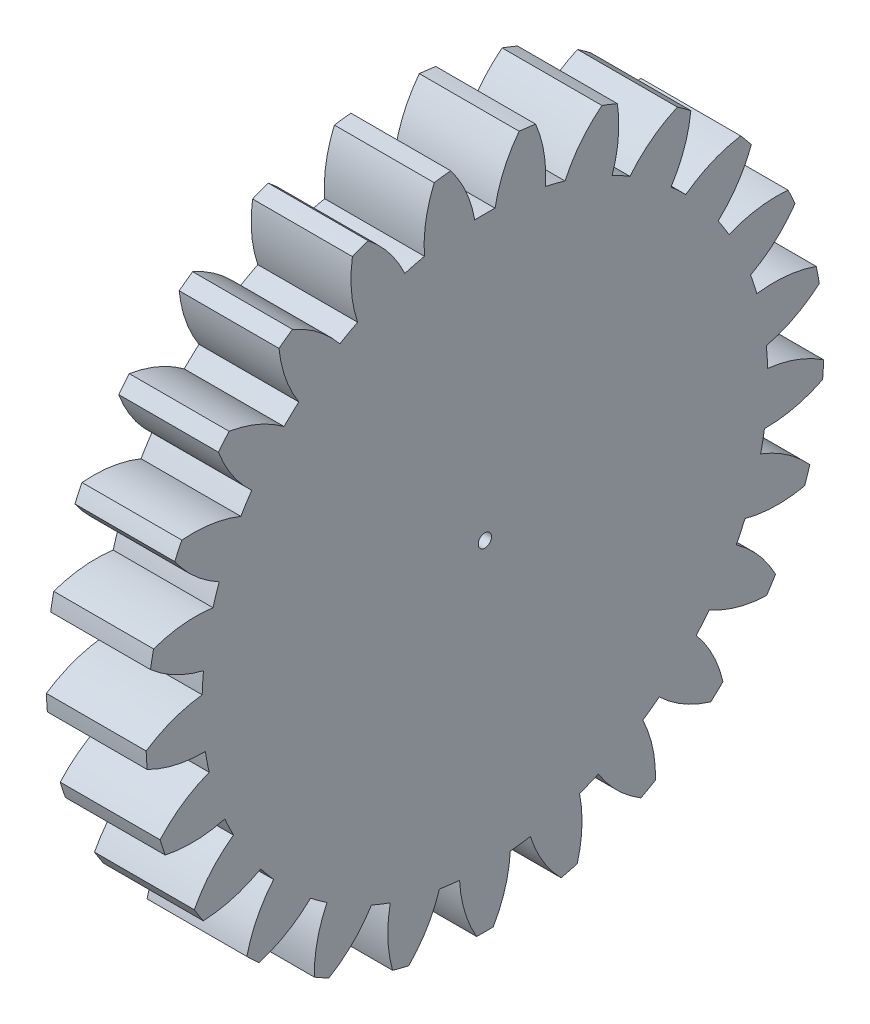
from build123d import *

# Parameters (mm, degrees)
BASPROSKE_W         = 6
BASPROSKE_H         = 20.25
TOOTHCUT_DEPTH      = 30.259613805
TEETHCUTS_COUNT     = 25
TEETHCUTS_ANGLE     = 345.6
BORSKE_R            = 0.4
BORE_DEPTH          = 50.0000508
SKETCH1_R           = 0.4
BOSS_EXTRUDE1_DEPTH = 6


with BuildPart() as part:
    # BasProSke → Base-Revolve (revolve)
    with BuildSketch(Plane(origin=(0, 0, 0), x_dir=(1, 0, 0), z_dir=(0, 1, 0)), mode=Mode.PRIVATE) as base_revolve_sk:
        with Locations((3, 10.125)):
            Rectangle(BASPROSKE_W, BASPROSKE_H)
    revolve(base_revolve_sk.sketch.rotate(Axis((-10, 0, 0), (1, 0, 0)), 180), axis=Axis((-10, 0, 0), (1, 0, 0)))

    # TooCutSke → ToothCut (cut, through all)
    with BuildSketch(Plane(origin=(0, 0, 0), x_dir=(0, 0, -1), z_dir=(1, 0, 0))):
        with BuildLine():
            ThreePointArc((0.713909619, 16.858891098), (0, 16.874), (-0.713909619, 16.858891098))
            ThreePointArc((-0.713909619, 16.858891098), (-1.221902209, 18.597177626), (-2.131751691, 20.163022588))
            ThreePointArc((-2.131751691, 20.163022588), (0, 20.2754), (2.131751691, 20.163022588))
            ThreePointArc((2.131751691, 20.163022588), (1.221902209, 18.597177626), (0.713909619, 16.858891098))
        make_face()
    toothcut = extrude(amount=TOOTHCUT_DEPTH, mode=Mode.SUBTRACT)

    # TeethCuts: ToothCut ×25 about axis
    teethcuts_axis = Axis((-10, 0, 0), (1, 0, 0))
    for i in range(1, TEETHCUTS_COUNT):
        add(toothcut.rotate(teethcuts_axis, i * TEETHCUTS_ANGLE / (TEETHCUTS_COUNT - 1)), mode=Mode.SUBTRACT)

    # BorSke → Bore (cut, symmetric)
    with BuildSketch(Plane(origin=(0, 0, 0), x_dir=(0, 0, -1), z_dir=(1, 0, 0))):
        with Locations(Location((0, 0, 0), (0, 0, 180))):
            Circle(BORSKE_R)
    extrude(amount=BORE_DEPTH, both=True, mode=Mode.SUBTRACT)

    # Sketch1 → Boss-Extrude1 (add)
    with BuildSketch(Plane(origin=(6, 0, 0), x_dir=(0, 0, -1), z_dir=(1, 0, 0))):
        with BuildLine():
            ThreePointArc((7.033321313, 19.122578704), (5.755923301, 17.845039552), (4.814939591, 16.302832813))
            ThreePointArc((4.814939591, 16.302832813), (4.227479392, 16.464945156), (3.634585878, 16.605896136))
            ThreePointArc((3.634585878, 16.605896136), (3.55295933, 18.410664563), (3.049026099, 20.145571842))
            ThreePointArc((3.049026099, 20.145571842), (2.553664634, 20.214337039), (2.056764651, 20.270923614))
            ThreePointArc((2.056764651, 20.270923614), (1.137209513, 18.715844736), (0.609319757, 16.988076125))
            ThreePointArc((0.609319757, 16.988076125), (0, 16.999), (-0.609319757, 16.988076125))
            ThreePointArc((-0.609319757, 16.988076125), (-1.137209513, 18.715844736), (-2.056764651, 20.270923614))
            ThreePointArc((-2.056764651, 20.270923614), (-2.553664634, 20.214337039), (-3.049026099, 20.145571842))
            ThreePointArc((-3.049026099, 20.145571842), (-3.55295933, 18.410664563), (-3.634585878, 16.605896136))
            ThreePointArc((-3.634585878, 16.605896136), (-4.227479392, 16.464945156), (-4.814939591, 16.302832813))
            ThreePointArc((-4.814939591, 16.302832813), (-5.755923301, 17.845039552), (-7.033321313, 19.122578704))
            ThreePointArc((-7.033321313, 19.122578704), (-7.500537761, 18.9441959), (-7.963235326, 18.754399701))
            ThreePointArc((-7.963235326, 18.754399701), (-8.019882673, 16.948674626), (-7.650117116, 15.180306621))
            ThreePointArc((-7.650117116, 15.180306621), (-8.189330706, 14.896337254), (-8.718019063, 14.593222558))
            ThreePointArc((-8.718019063, 14.593222558), (-10.012971259, 15.852964904), (-11.567948531, 16.772691847))
            ThreePointArc((-11.567948531, 16.772691847), (-11.976124515, 16.48372126), (-12.37708519, 16.184819653))
            ThreePointArc((-12.37708519, 16.184819653), (-11.982887291, 14.421737129), (-11.18496336, 12.800882612))
            ThreePointArc((-11.18496336, 12.800882612), (-11.636616254, 12.391737698), (-12.073313334, 11.966666459))
            ThreePointArc((-12.073313334, 11.966666459), (-13.640867407, 12.864790167), (-15.375718999, 13.368915074))
            ThreePointArc((-15.375718999, 13.368915074), (-15.699207322, 12.987513791), (-16.013237272, 12.598287862))
            ThreePointArc((-16.013237272, 12.598287862), (-15.192963031, 10.988628849), (-14.01701722, 9.61713207))
            ThreePointArc((-14.01701722, 9.61713207), (-14.352730406, 9.108519688), (-14.669996926, 8.588200696))
            ThreePointArc((-14.669996926, 8.588200696), (-16.411657689, 9.068273351), (-18.217376494, 9.125120201))
            ThreePointArc((-18.217376494, 9.125120201), (-18.435851194, 8.675253066), (-18.643218764, 8.220159312))
            ThreePointArc((-18.643218764, 8.220159312), (-17.448409029, 6.865064605), (-15.968330338, 5.82910175))
            ThreePointArc((-15.968330338, 5.82910175), (-16.167009721, 5.252979887), (-16.344910658, 4.670106699))
            ThreePointArc((-16.344910658, 4.670106699), (-18.15124316, 4.70196357), (-19.914369225, 4.307960465))
            ThreePointArc((-19.914369225, 4.307960465), (-20.014102734, 3.817894285), (-20.101778256, 3.32552792))
            ThreePointArc((-20.101778256, 3.32552792), (-18.607507316, 2.310143104), (-16.916294533, 1.674807529))
            ThreePointArc((-16.916294533, 1.674807529), (-16.965456357, 1.067376041), (-16.992813542, 0.458572722))
            ThreePointArc((-16.992813542, 0.458572722), (-18.750319268, 0.040212124), (-20.360068898, -0.77988427))
            ThreePointArc((-20.360068898, -0.77988427), (-20.334794592, -1.279356835), (-20.297269091, -1.778058621))
            ThreePointArc((-20.297269091, -1.778058621), (-18.597427484, -2.389933184), (-16.801345729, -2.584721008))
            ThreePointArc((-16.801345729, -2.584721008), (-16.697900975, -3.185294967), (-16.572995455, -3.781775066))
            ThreePointArc((-16.572995455, -3.781775066), (-18.171243857, -4.624065996), (-19.526470563, -5.818726009))
            ThreePointArc((-19.526470563, -5.818726009), (-19.37777652, -6.29622126), (-19.21740786, -6.769923199))
            ThreePointArc((-19.21740786, -6.769923199), (-17.418802888, -6.939841181), (-15.630706582, -6.681842018))
            ThreePointArc((-15.630706582, -6.681842018), (-15.381155065, -7.237822177), (-15.111835113, -7.784500017))
            ThreePointArc((-15.111835113, -7.784500017), (-16.450402366, -8.997797045), (-17.465952269, -10.491955792))
            ThreePointArc((-17.465952269, -10.491955792), (-17.203181482, -10.917470948), (-16.930046218, -11.336408605))
            ThreePointArc((-16.930046218, -11.336408605), (-15.145690844, -11.053693433), (-13.477932654, -10.35911832))
            ThreePointArc((-13.477932654, -10.35911832), (-13.097954614, -10.835570402), (-12.701142593, -11.298096204))
            ThreePointArc((-12.701142593, -11.298096204), (-13.695921594, -12.806163413), (-14.307983958, -14.505937407))
            ThreePointArc((-14.307983958, -14.505937407), (-13.947647283, -14.852735784), (-13.578907507, -15.190585766))
            ThreePointArc((-13.578907507, -15.190585766), (-11.920919342, -14.473001475), (-10.47829065, -13.38549312))
            ThreePointArc((-10.47829065, -13.38549312), (-9.991761504, -13.752479887), (-9.492390573, -14.101791454))
            ThreePointArc((-9.492390573, -14.101791454), (-10.080875698, -15.809871436), (-10.250992395, -17.608457625))
            ThreePointArc((-10.250992395, -17.608457625), (-9.81573111, -17.854748606), (-9.374556097, -18.090282557))
            ThreePointArc((-9.374556097, -18.090282557), (-7.947112637, -16.982917606), (-6.820259107, -15.570808159))
            ThreePointArc((-6.820259107, -15.570808159), (-6.257749271, -15.805270484), (-5.687196742, -16.019419285))
            ThreePointArc((-5.687196742, -16.019419285), (-5.832411307, -17.820187093), (-5.549893279, -19.604573691))
            ThreePointArc((-5.549893279, -19.604573691), (-5.067056451, -19.734881908), (-4.581166851, -19.853300363))
            ThreePointArc((-4.581166851, -19.853300363), (-3.473959616, -18.425734565), (-2.733685602, -16.777752055))
            ThreePointArc((-2.733685602, -16.777752055), (-2.130539637, -16.864957808), (-1.524655424, -16.930488086))
            ThreePointArc((-1.524655424, -16.930488086), (-1.217475063, -18.710794856), (-0.500073957, -20.368862291))
            ThreePointArc((-0.500073957, -20.368862291), (0, -20.375), (0.500073957, -20.368862291))
            ThreePointArc((0.500073957, -20.368862291), (1.217475063, -18.710794856), (1.524655424, -16.930488086))
            ThreePointArc((1.524655424, -16.930488086), (2.130539637, -16.864957808), (2.733685602, -16.777752055))
            ThreePointArc((2.733685602, -16.777752055), (3.473959616, -18.425734565), (4.581166851, -19.853300363))
            ThreePointArc((4.581166851, -19.853300363), (5.067056451, -19.734881908), (5.549893279, -19.604573691))
            ThreePointArc((5.549893279, -19.604573691), (5.832411307, -17.820187093), (5.687196742, -16.019419285))
            ThreePointArc((5.687196742, -16.019419285), (6.257749271, -15.805270484), (6.820259107, -15.570808159))
            ThreePointArc((6.820259107, -15.570808159), (7.947112637, -16.982917606), (9.374556097, -18.090282557))
            ThreePointArc((9.374556097, -18.090282557), (9.81573111, -17.854748606), (10.250992395, -17.608457625))
            ThreePointArc((10.250992395, -17.608457625), (10.080875698, -15.809871436), (9.492390573, -14.101791454))
            ThreePointArc((9.492390573, -14.101791454), (9.991761504, -13.752479887), (10.47829065, -13.38549312))
            ThreePointArc((10.47829065, -13.38549312), (11.920919342, -14.473001475), (13.578907507, -15.190585766))
            ThreePointArc((13.578907507, -15.190585766), (13.947647283, -14.852735784), (14.307983958, -14.505937407))
            ThreePointArc((14.307983958, -14.505937407), (13.695921594, -12.806163413), (12.701142593, -11.298096204))
            ThreePointArc((12.701142593, -11.298096204), (13.097954614, -10.835570402), (13.477932654, -10.35911832))
            ThreePointArc((13.477932654, -10.35911832), (15.145690844, -11.053693433), (16.930046218, -11.336408605))
            ThreePointArc((16.930046218, -11.336408605), (17.203181482, -10.917470948), (17.465952269, -10.491955792))
            ThreePointArc((17.465952269, -10.491955792), (16.450402366, -8.997797045), (15.111835113, -7.784500017))
            ThreePointArc((15.111835113, -7.784500017), (15.381155065, -7.237822177), (15.630706582, -6.681842018))
            ThreePointArc((15.630706582, -6.681842018), (17.418802888, -6.939841181), (19.21740786, -6.769923199))
            ThreePointArc((19.21740786, -6.769923199), (19.37777652, -6.29622126), (19.526470563, -5.818726009))
            ThreePointArc((19.526470563, -5.818726009), (18.171243857, -4.624065996), (16.572995455, -3.781775066))
            ThreePointArc((16.572995455, -3.781775066), (16.697900975, -3.185294967), (16.801345729, -2.584721008))
            ThreePointArc((16.801345729, -2.584721008), (18.597427484, -2.389933184), (20.297269091, -1.778058621))
            ThreePointArc((20.297269091, -1.778058621), (20.334794592, -1.279356835), (20.360068898, -0.77988427))
            ThreePointArc((20.360068898, -0.77988427), (18.750319268, 0.040212124), (16.992813542, 0.458572722))
            ThreePointArc((16.992813542, 0.458572722), (16.965456357, 1.067376041), (16.916294533, 1.674807529))
            ThreePointArc((16.916294533, 1.674807529), (18.607507316, 2.310143104), (20.101778256, 3.32552792))
            ThreePointArc((20.101778256, 3.32552792), (20.014102734, 3.817894285), (19.914369225, 4.307960465))
            ThreePointArc((19.914369225, 4.307960465), (18.15124316, 4.70196357), (16.344910658, 4.670106699))
            ThreePointArc((16.344910658, 4.670106699), (16.167009721, 5.252979887), (15.968330338, 5.82910175))
            ThreePointArc((15.968330338, 5.82910175), (17.448409029, 6.865064605), (18.643218764, 8.220159312))
            ThreePointArc((18.643218764, 8.220159312), (18.435851194, 8.675253066), (18.217376494, 9.125120201))
            ThreePointArc((18.217376494, 9.125120201), (16.411657689, 9.068273351), (14.669996926, 8.588200696))
            ThreePointArc((14.669996926, 8.588200696), (14.352730406, 9.108519688), (14.01701722, 9.61713207))
            ThreePointArc((14.01701722, 9.61713207), (15.192963031, 10.988628849), (16.013237272, 12.598287862))
            ThreePointArc((16.013237272, 12.598287862), (15.699207322, 12.987513791), (15.375718999, 13.368915074))
            ThreePointArc((15.375718999, 13.368915074), (13.640867407, 12.864790167), (12.073313334, 11.966666459))
            ThreePointArc((12.073313334, 11.966666459), (11.636616254, 12.391737698), (11.18496336, 12.800882612))
            ThreePointArc((11.18496336, 12.800882612), (11.982887291, 14.421737129), (12.37708519, 16.184819653))
            ThreePointArc((12.37708519, 16.184819653), (11.976124515, 16.48372126), (11.567948531, 16.772691847))
            ThreePointArc((11.567948531, 16.772691847), (10.012971259, 15.852964904), (8.718019063, 14.593222558))
            ThreePointArc((8.718019063, 14.593222558), (8.189330706, 14.896337254), (7.650117116, 15.180306621))
            ThreePointArc((7.650117116, 15.180306621), (8.019882673, 16.948674626), (7.963235326, 18.754399701))
            ThreePointArc((7.963235326, 18.754399701), (7.500537761, 18.9441959), (7.033321313, 19.122578704))
        make_face()
        with Locations(Location((0, 0, 0), (0, 0, 180))):
            Circle(SKETCH1_R, mode=Mode.SUBTRACT)
    extrude(amount=-BOSS_EXTRUDE1_DEPTH)


solid = part.part
